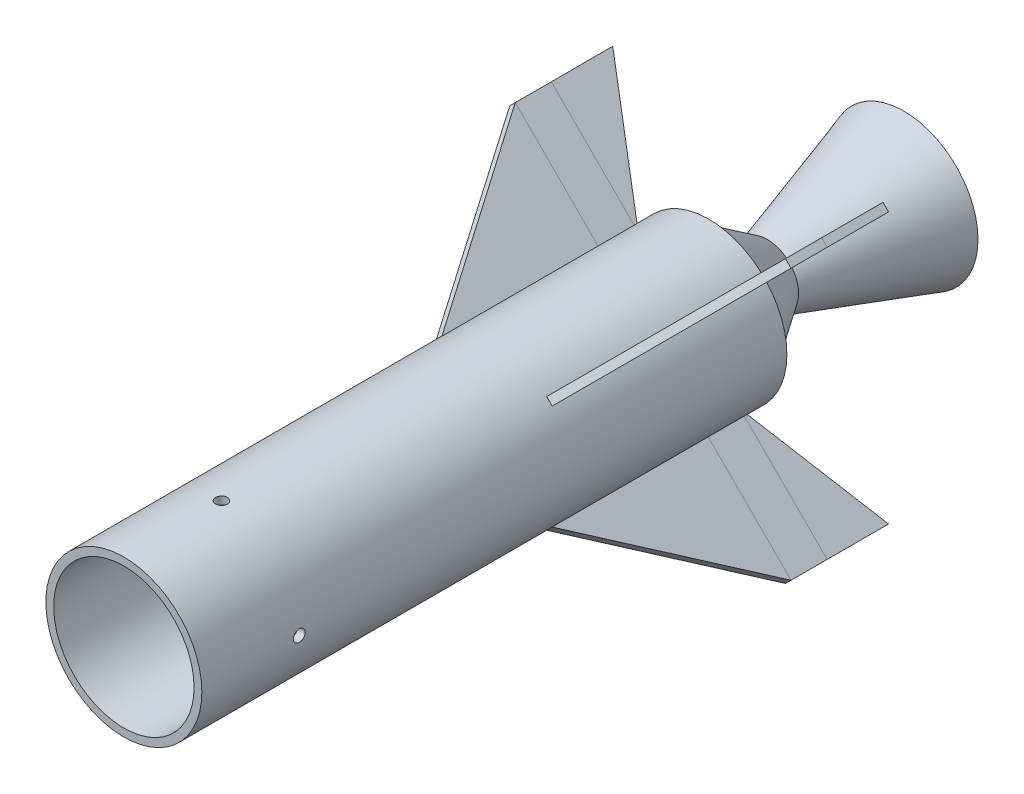
from build123d import *

# Parameters (mm, degrees)
SKETCH_1_R               = 40
EXTRUDE_1_DEPTH          = 300
SKETCH_2_R               = 36
CUT_EXTRUDE_1_DEPTH      = 292
SKETCH_4_R               = 3
CUT_EXTRUDE_2_DEPTH      = 5
SKETCH_5_R               = 3
CUT_EXTRUDE_3_DEPTH      = 5
CUT_EXTRUDE_START        = 5
SKETCH_6_R               = 3
CUT_EXTRUDE_4_DEPTH      = 5
SKETCH_7_R               = 3
CUT_EXTRUDE_5_DEPTH      = 5
PATTERN_CIRCULAR_6_COUNT = 4
EXTRUDE_4_DEPTH          = 18.5
PATTERN_CIRCULAR_7_COUNT = 4
PATTERN_CIRCULAR_8_COUNT = 4
SKETCH_46_R              = 30
CUT_EXTRUDE_7_DEPTH      = 8


with BuildPart() as part:
    # 草图1 → 凸台-拉伸1 (new body)
    with BuildSketch(Plane.XY):
        Circle(SKETCH_1_R)
    extrude(amount=EXTRUDE_1_DEPTH)

    # 草图2 → 切除-拉伸1 (cut)
    with BuildSketch(Plane.XY.offset(8)):
        Circle(SKETCH_2_R)
    extrude(amount=CUT_EXTRUDE_1_DEPTH, mode=Mode.SUBTRACT)

    # 草图4 → 切除-拉伸2 (cut)
    with BuildSketch(Plane(origin=(40, 0, 0), x_dir=(0, 0, -1), z_dir=(1, 0, 0))):
        with Locations((-250, 0)):
            Circle(SKETCH_4_R)
    extrude(amount=-CUT_EXTRUDE_2_DEPTH, mode=Mode.SUBTRACT)

    # 草图5 → 切除-拉伸3 (cut)
    with BuildSketch(Plane(origin=(0, 40, 0), x_dir=(1, 0, 0), z_dir=(0, 1, 0))):
        with Locations((0, -250)):
            Circle(SKETCH_5_R)
    extrude(amount=-CUT_EXTRUDE_3_DEPTH, mode=Mode.SUBTRACT)

    # 草图6 → 切除-拉伸4 (cut)
    with BuildSketch(Plane(origin=(-40, 0, 0), x_dir=(0, 0, -1), z_dir=(1, 0, 0)).offset(CUT_EXTRUDE_START)):
        with Locations((-250, 0)):
            Circle(SKETCH_6_R)
    extrude(amount=-CUT_EXTRUDE_4_DEPTH, mode=Mode.SUBTRACT)

    # 草图7 → 切除-拉伸5 (cut)
    with BuildSketch(Plane(origin=(0, -40, 0), x_dir=(1, 0, 0), z_dir=(0, 1, 0)).offset(CUT_EXTRUDE_START)):
        with Locations((0, -250)):
            Circle(SKETCH_7_R)
    extrude(amount=-CUT_EXTRUDE_5_DEPTH, mode=Mode.SUBTRACT)

    # 草图21 → 旋转3 (revolve)
    with BuildSketch(Plane(origin=(0, 0, 0), x_dir=(1, 0, 0), z_dir=(0, 1, 0))):
        Polygon((30, 0), (12, 30), (34, 100), (38, 100), (16, 30), (36, 0), align=None)
    revolve(axis=Axis((0, 0, 0), (0, 0, -1)))

    # 草图41 → 放样10 section 0
    with BuildSketch(Plane.XY.offset(-20)):
        with BuildLine():
            Line((69.28936, 72.11778), (69.30346, 72.13188))
            Line((69.30346, 72.13188), (72.13188, 69.30346))
            Line((72.13188, 69.30346), (72.11778, 69.28936))
            Line((72.11778, 69.28936), (69.28936, 72.11778))
        make_face()
    # 草图42 → 放样10 section 1
    with BuildSketch(Plane.XY.offset(11.5)):
        with BuildLine():
            Line((24.7487, 27.5771), (69.2964, 72.1249))
            Line((69.2964, 72.1249), (72.1249, 69.2964))
            Line((72.1249, 69.2964), (27.5771, 24.7487))
            Line((27.5771, 24.7487), (24.7487, 27.5771))
        make_face()
    loft_10 = loft()

    # 阵列(圆周)6: 放样10 ×4 about axis
    pattern_circular_6_axis = Axis((0, 0, 320), (0, 0, -1))
    for i in range(1, PATTERN_CIRCULAR_6_COUNT):
        add(loft_10.rotate(pattern_circular_6_axis, i * 360 / PATTERN_CIRCULAR_6_COUNT))

    # 草图43 → 凸台-拉伸4 (add)
    with BuildSketch(Plane.XY.offset(11.5)):
        Polygon((24.7487, 27.5771), (69.2964, 72.1249), (72.1249, 69.2964), (27.5771, 24.7487), align=None)
    extrude_4 = extrude(amount=EXTRUDE_4_DEPTH)

    # 阵列(圆周)7: 凸台-拉伸4 ×4 about axis
    pattern_circular_7_axis = Axis((0, 0, 320), (0, 0, -1))
    for i in range(1, PATTERN_CIRCULAR_7_COUNT):
        add(extrude_4.rotate(pattern_circular_7_axis, i * 360 / PATTERN_CIRCULAR_7_COUNT))

    # 草图44 → 放样11 section 0
    with BuildSketch(Plane.XY.offset(30)):
        with BuildLine():
            Line((24.7487, 27.5771), (69.2964, 72.1249))
            Line((69.2964, 72.1249), (72.1249, 69.2964))
            Line((72.1249, 69.2964), (27.5771, 24.7487))
            Line((27.5771, 24.7487), (24.7487, 27.5771))
        make_face()
    # 草图45 → 放样11 section 1
    with BuildSketch(Plane.XY.offset(114)):
        with BuildLine():
            Line((24.74205, 27.57047), (24.75645, 27.58487))
            Line((24.75645, 27.58487), (27.58487, 24.75645))
            Line((27.58487, 24.75645), (27.57047, 24.74205))
            Line((27.57047, 24.74205), (24.74205, 27.57047))
        make_face()
    loft_11 = loft()

    # 阵列(圆周)8: 放样11 ×4 about axis
    pattern_circular_8_axis = Axis((0, 0, 320), (0, 0, -1))
    for i in range(1, PATTERN_CIRCULAR_8_COUNT):
        add(loft_11.rotate(pattern_circular_8_axis, i * 360 / PATTERN_CIRCULAR_8_COUNT))

    # 草图46 → 切除-拉伸7 (cut)
    with BuildSketch(Plane.XY):
        Circle(SKETCH_46_R)
    extrude(amount=CUT_EXTRUDE_7_DEPTH, mode=Mode.SUBTRACT)


solid = part.part
